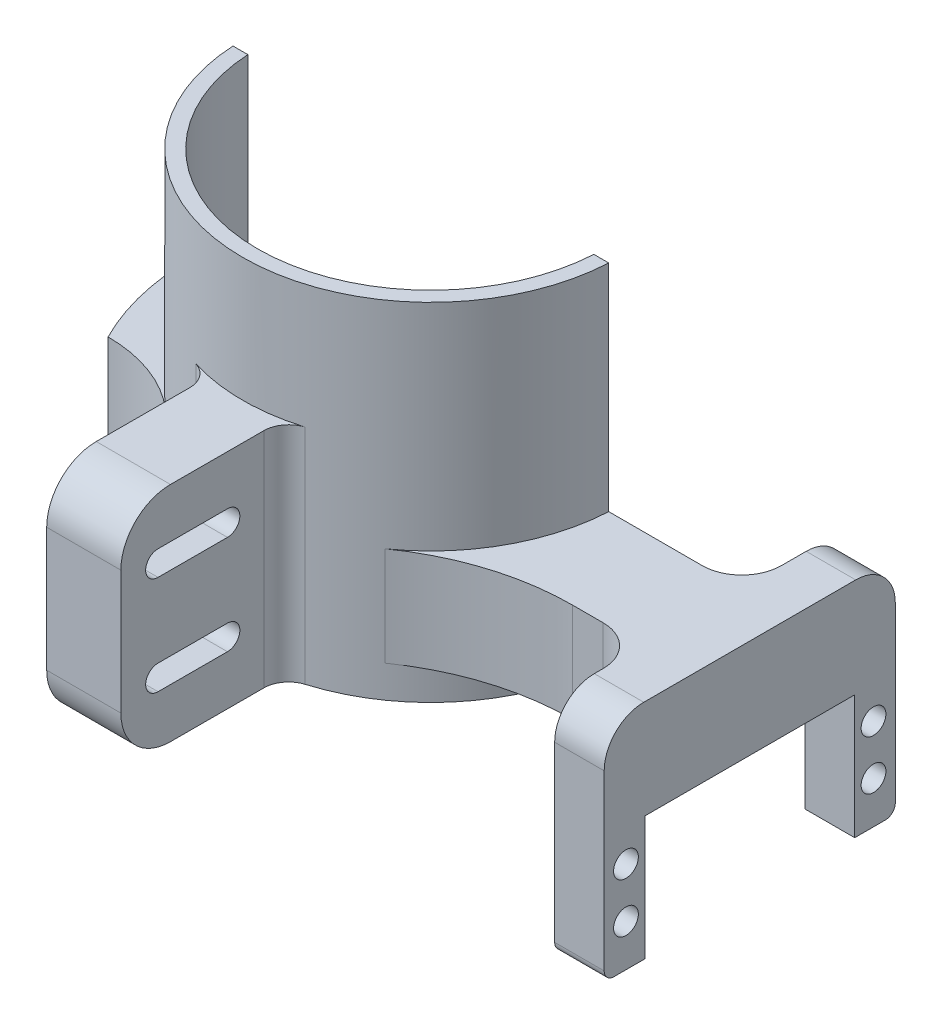
from build123d import *

# Parameters (mm, degrees)
BOSS_EXTRU_1_DEPTH             = 70
BOSS_EXTRU_2_START             = -45
BOSS_EXTRU_2_DEPTH             = 45
ENL_V_MAT_EXTRU_1_DEPTH        = 15
BOSS_EXTRU_6_START             = -20
BOSS_EXTRU_6_DEPTH             = 20
ESQUISSE10_W                   = 8.2
ESQUISSE10_H                   = 25
ESQUISSE10_R                   = 2.5
BOSS_EXTRU_7_DEPTH             = 10
BOSS_EXTRU_8_DEPTH             = 8
BOSS_EXTRU_8_DIRECTION_2_REACH = 120.835
ESQUISSE12_R                   = 10
ENL_V_MAT_EXTRU_2_DEPTH        = 42.773769853
ESQUISSE13_R                   = 2.25
ENL_V_MAT_EXTRU_3_DEPTH        = 65
CONG_5_R                       = 5
CONG_6_R                       = 50
CONG_7_R                       = 5
CONG_8_R                       = 8
CONG_9_R                       = 8
CONG_10_R                      = 2
CONG_11_R                      = 10


with BuildPart() as part:
    # Esquisse1 → Boss.-Extru.1 (new body)
    with BuildSketch(Plane(origin=(0, 11.1, 0), x_dir=(0, 0, 1), z_dir=(0, -1, 0))):
        with BuildLine():
            Line((-14.419058892, 37.773769853), (-14.419058892, 34.76924835))
            ThreePointArc((-14.419058892, 34.76924835), (18.580941108, -0.173562069), (-14.419058892, -35.116372489))
            Line((-14.419058892, -35.116372489), (-14.419058892, -38.120893991))
            ThreePointArc((-14.419058892, -38.120893991), (21.580941108, -0.173562069), (-14.419058892, 37.773769853))
        make_face()
    extrude(amount=BOSS_EXTRU_1_DEPTH)

    # Esquisse2 → Boss.-Extru.2 (add)
    with BuildSketch(Plane.XZ.offset(58.9).offset(BOSS_EXTRU_2_START)):
        with BuildLine():
            Line((-7.36953704, 20.824754767), (-7.407428488, 53.572216152))
            Line((-7.407428488, 53.572216152), (7.592561471, 53.589572347))
            Line((7.592561471, 53.589572347), (7.630452918, 20.842110962))
            ThreePointArc((7.630452918, 20.842110962), (0.129593041, 21.580915671), (-7.36953704, 20.824754767))
        make_face()
    extrude(amount=BOSS_EXTRU_2_DEPTH)

    # Esquisse3 → Enlèv. mat.-Extru.1 (cut)
    with BuildSketch(Plane(origin=(-7.345431289, 0, -0.008499255), x_dir=(-0.0011570796870464528, 0, 0.999999330583075), z_dir=(-0.999999330583075, 0, -0.0011570796870464528))):
        with BuildLine():
            Line((46.080751274, -28.9), (32.080751274, -28.9))
            ThreePointArc((32.080751274, -28.9), (29.580751274, -26.4), (32.080751274, -23.9))
            Line((32.080751274, -23.9), (46.080751274, -23.9))
            ThreePointArc((46.080751274, -23.9), (48.580751274, -26.4), (46.080751274, -28.9))
        make_face()
        with BuildLine():
            Line((32.080751274, -43.9), (46.080751274, -43.9))
            ThreePointArc((46.080751274, -43.9), (48.580751274, -46.4), (46.080751274, -48.9))
            Line((46.080751274, -48.9), (32.080751274, -48.9))
            ThreePointArc((32.080751274, -48.9), (29.580751274, -46.4), (32.080751274, -43.9))
        make_face()
    extrude(amount=-ENL_V_MAT_EXTRU_1_DEPTH, mode=Mode.SUBTRACT)

    # Esquisse5 → Boss.-Extru.6 (add)
    with BuildSketch(Plane.XZ.offset(52.4).offset(BOSS_EXTRU_6_START)):
        with BuildLine():
            Line((38.120893991, -14.419058892), (65, -14.419058892))
            Line((65, -14.419058892), (65, -35.419058892))
            Line((65, -35.419058892), (75, -35.419058892))
            Line((75, -35.419058892), (75, 23.380941108))
            Line((75, 23.380941108), (65, 23.380941108))
            Line((65, 23.380941108), (65, 5.580941108))
            Line((65, 5.580941108), (31.157428839, 5.580941108))
            ThreePointArc((31.157428839, 5.580941108), (36.060572787, -3.924161464), (38.120893991, -14.419058892))
        make_face()
    extrude(amount=BOSS_EXTRU_6_DEPTH)

    # Esquisse10 → Boss.-Extru.7 (add)
    # profile 1 of 2: a face of its own
    with BuildSketch(Plane(origin=(75, 0, 0), x_dir=(0, 0, -1), z_dir=(1, 0, 0))):
        with Locations((-19.280941108, -64.9)):
            Rectangle(ESQUISSE10_W, ESQUISSE10_H)
        with Locations((-18.980941108, -58.9)):
            Circle(ESQUISSE10_R, mode=Mode.SUBTRACT)
        with Locations((-18.980941108, -68.9)):
            Circle(ESQUISSE10_R, mode=Mode.SUBTRACT)
    # profile 2 of 2: a face of its own
    with BuildSketch(Plane(origin=(75, 0, 0), x_dir=(0, 0, -1), z_dir=(1, 0, 0))):
        with Locations((31.319058892, -64.9)):
            Rectangle(ESQUISSE10_W, ESQUISSE10_H)
        with Locations((31.019058892, -58.9)):
            Circle(ESQUISSE10_R, mode=Mode.SUBTRACT)
        with Locations((31.019058892, -68.9)):
            Circle(ESQUISSE10_R, mode=Mode.SUBTRACT)
    extrude(amount=-BOSS_EXTRU_7_DEPTH)

    # Esquisse11 → Boss.-Extru.8 (add)
    with BuildSketch(Plane(origin=(0, -63.9, 0), x_dir=(0, 0, 1), z_dir=(0, -1, 0))):
        with BuildLine():
            Line((-14.419058892, 37.773769853), (-14.419058892, 42.773769853))
            Line((-14.419058892, 42.773769853), (-23.419058892, 42.773769853))
            Line((-23.419058892, 42.773769853), (-23.419058892, 47.773769853))
            ThreePointArc((-23.419058892, 47.773769853), (-8.548386036, 47.638561364), (5.580941108, 42.999886235))
            ThreePointArc((5.580941108, 42.999886235), (7.341400367, 33.183529475), (12.403351613, 24.590699533))
            Line((12.403351613, 24.590699533), (10.127898152, 22.635626249))
            ThreePointArc((10.127898152, 22.635626249), (-0.909758926, 31.202569218), (-14.419058892, 34.76924835))
            Line((-14.419058892, 34.76924835), (-14.419058892, 37.773769853))
        make_face()
    extrude(amount=BOSS_EXTRU_8_DEPTH)

    # Boss.-Extru.8 direction 2: up to this face of the body (flat: up to its plane)
    boss_extru_8_direction_2_end = Plane(part.part.faces().sort_by_distance((60.159129099, -32.4, -5.026373369))[0])
    # Esquisse11 → Boss.-Extru.8 direction 2 (add, up to the picked face)
    with BuildSketch(Plane(origin=(0, -63.9, 0), x_dir=(0, 0, 1), z_dir=(0, -1, 0)), mode=Mode.PRIVATE) as boss_extru_8_direction_2_sk1:
        with BuildLine():
            Line((-14.419058892, 37.773769853), (-14.419058892, 42.773769853))
            Line((-14.419058892, 42.773769853), (-23.419058892, 42.773769853))
            Line((-23.419058892, 42.773769853), (-23.419058892, 47.773769853))
            ThreePointArc((-23.419058892, 47.773769853), (-8.548386036, 47.638561364), (5.580941108, 42.999886235))
            ThreePointArc((5.580941108, 42.999886235), (7.341400367, 33.183529475), (12.403351613, 24.590699533))
            Line((12.403351613, 24.590699533), (10.127898152, 22.635626249))
            ThreePointArc((10.127898152, 22.635626249), (-0.909758926, 31.202569218), (-14.419058892, 34.76924835))
            Line((-14.419058892, 34.76924835), (-14.419058892, 37.773769853))
        make_face()
    boss_extru_8_direction_2_tool1 = split(extrude(boss_extru_8_direction_2_sk1.sketch, amount=-BOSS_EXTRU_8_DIRECTION_2_REACH, mode=Mode.PRIVATE), bisect_by=boss_extru_8_direction_2_end, keep=Keep.BOTH, mode=Mode.PRIVATE)
    add(boss_extru_8_direction_2_tool1.solids().sort_by(Axis((-38.873879, -63.9, -4.751333), (0, 1, 0)))[0])

    # Esquisse12 → Enlèv. mat.-Extru.2 (cut)
    with BuildSketch(Plane(origin=(0, 0, 0), x_dir=(0, 0, -1), z_dir=(1, 0, 0))):
        with Locations((16.419058892, -63.9)):
            Circle(ESQUISSE12_R)
    extrude(amount=-ENL_V_MAT_EXTRU_2_DEPTH, mode=Mode.SUBTRACT)

    # Esquisse13 → Enlèv. mat.-Extru.3 (cut)
    with BuildSketch(Plane(origin=(0, 0, 0), x_dir=(0, 0, -1), z_dir=(1, 0, 0))):
        with Locations((16.419058892, -63.9)):
            Circle(ESQUISSE13_R)
        Polygon((14.419058892, -32.4), (23.419058892, -32.4), (23.419058892, -56.758571571), align=None)
    extrude(amount=-ENL_V_MAT_EXTRU_3_DEPTH, mode=Mode.SUBTRACT)

    # Congé5
    cong_5_edges = [part.edges().sort_by_distance(p)[0] for p in [
        (-45.273769853, -71.9, -23.419058892),
    ]]
    fillet(cong_5_edges, radius=CONG_5_R)

    # Congé6
    cong_6_edges = [part.edges().sort_by_distance(p)[0] for p in [
        (31.157428839, -42.4, 5.580941108),
    ]]
    fillet(cong_6_edges, radius=CONG_6_R)

    # Congé7
    cong_7_edges = [part.edges().sort_by_distance(p)[0] for p in [
        (7.630452918, -36.4, 20.842110962),
        (-7.36953704, -36.4, 20.824754767),
    ]]
    fillet(cong_7_edges, radius=CONG_7_R)

    # Congé8
    cong_8_edges = [part.edges().sort_by_distance(p)[0] for p in [
        (65, -42.4, 5.580941108),
        (65, -42.4, -14.419058892),
    ]]
    fillet(cong_8_edges, radius=CONG_8_R)

    # Congé9
    cong_9_edges = [part.edges().sort_by_distance(p)[0] for p in [
        (70, -32.4, 23.380941108),
        (70, -32.4, -35.419058892),
    ]]
    fillet(cong_9_edges, radius=CONG_9_R)

    # Congé10
    cong_10_edges = [part.edges().sort_by_distance(p)[0] for p in [
        (70, -77.4, 23.380941108),
        (70, -77.4, -35.419058892),
    ]]
    fillet(cong_10_edges, radius=CONG_10_R)

    # Congé11
    cong_11_edges = [part.edges().sort_by_distance(p)[0] for p in [
        (0.092566491, -13.9, 53.580894249),
        (0.092566491, -58.9, 53.580894249),
    ]]
    fillet(cong_11_edges, radius=CONG_11_R)


solid = part.part
